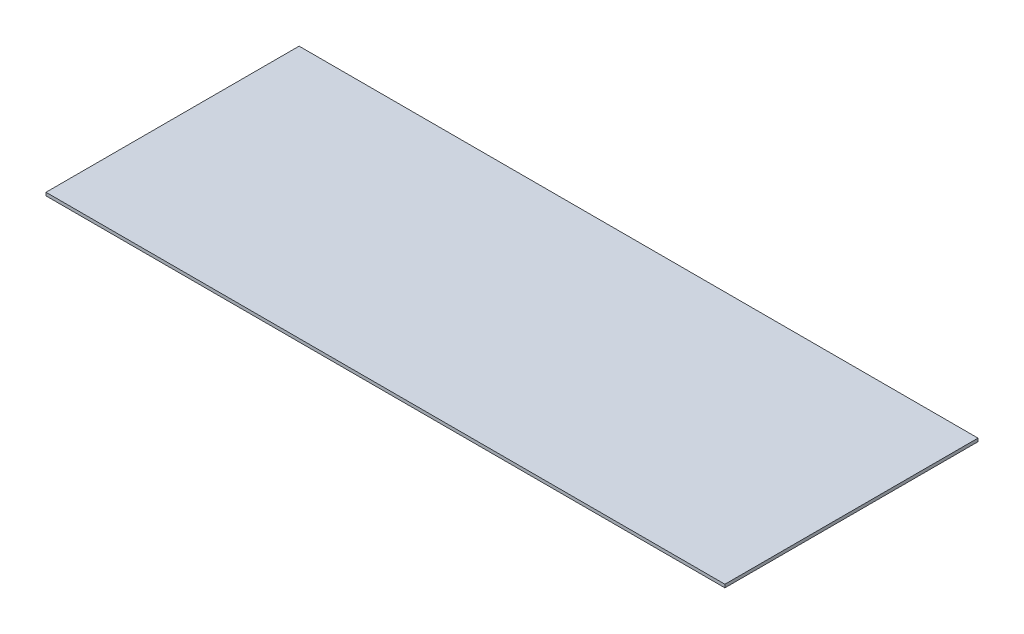
from build123d import *

# Parameters (mm, degrees)
CROQUIS1_W     = 1073
CROQUIS1_H     = 400
EXTRUIR1_DEPTH = 5


with BuildPart() as part:
    # Croquis1 → Extruir1 (new body)
    with BuildSketch(Plane(origin=(0, 0, 0), x_dir=(1, 0, 0), z_dir=(0, 1, 0))):
        Rectangle(CROQUIS1_W, CROQUIS1_H)
    extrude(amount=EXTRUIR1_DEPTH)


solid = part.part
